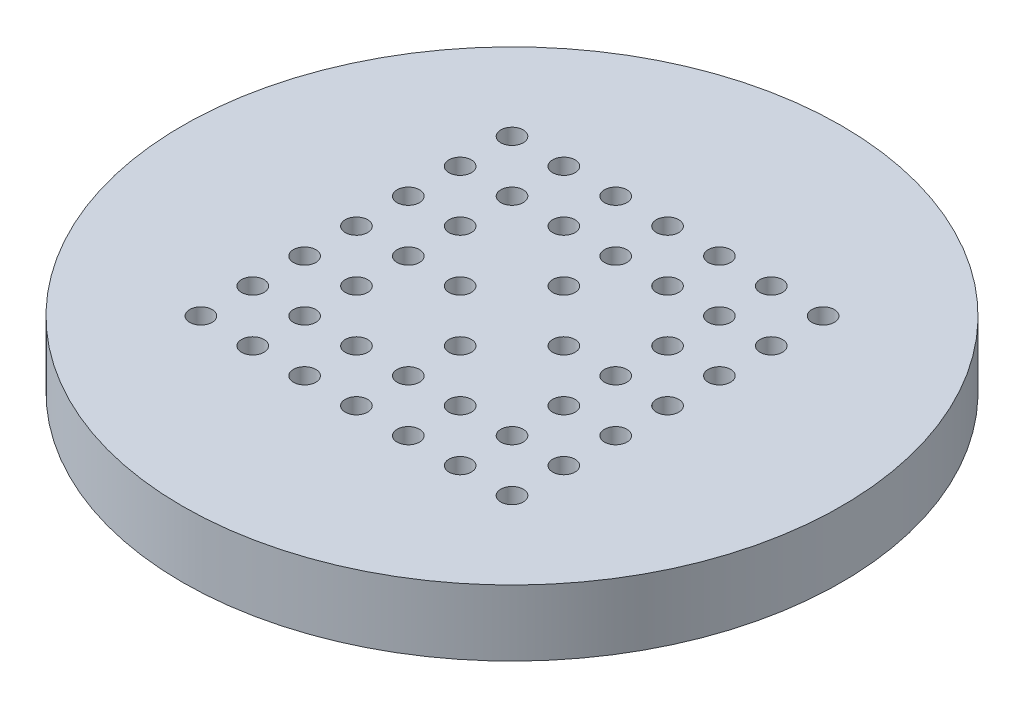
from build123d import *

# Parameters (mm, degrees)
SKETCH1_R                                 = 19.05
BILLET_DEPTH                              = 3.81
SKETCH2_R                                 = 0.6477
FIRST_LOX_HOLE_DEPTH                      = 28.208842313
BRAISING_CHAMFER_SIZE                     = 0.254
LOX_HOLE_PATTERN_COUNT                    = 7
LOX_HOLE_PATTERN_PITCH                    = 2.9972
LOX_HOLE_PATTERN_COUNT_DIR2               = 7
LOX_HOLE_PATTERN_PITCH_DIR2               = 2.9972
BRAISING_CHAMFER_OF_LOX_HOLE_PATTERN_SIZE = 0.254
SKETCH3_R                                 = 0.79375
DOWEL_HOLE_DEPTH                          = 1.905


with BuildPart() as part:
    # Sketch1 → Billet (new body)
    with BuildSketch(Plane(origin=(0, 0, 0), x_dir=(1, 0, 0), z_dir=(0, 1, 0))):
        Circle(SKETCH1_R)
    extrude(amount=-BILLET_DEPTH)

    # Sketch2 → First Lox Hole (cut, symmetric)
    with BuildSketch(Plane(origin=(0, 0, 0), x_dir=(1, 0, 0), z_dir=(0, 1, 0))):
        with Locations((8.9916, 8.9916)):
            Circle(SKETCH2_R)
    first_lox_hole = extrude(amount=FIRST_LOX_HOLE_DEPTH, both=True, mode=Mode.SUBTRACT)

    # Braising Chamfer
    braising_chamfer_edges = [part.edges().sort_by_distance(p)[0] for p in [
        (8.3439, -3.81, -8.9916),
    ]]
    chamfer(braising_chamfer_edges, length=BRAISING_CHAMFER_SIZE)

    # Lox Hole Pattern: First Lox Hole 7 × 7, 5 skipped
    with Locations(*[(-i * LOX_HOLE_PATTERN_PITCH, 0, j * LOX_HOLE_PATTERN_PITCH_DIR2) for i in range(LOX_HOLE_PATTERN_COUNT) for j in range(LOX_HOLE_PATTERN_COUNT_DIR2) if (i, j) not in ((0, 0), (2, 2), (2, 4), (3, 3), (4, 2), (4, 4))]):
        add(first_lox_hole, mode=Mode.SUBTRACT)

    # Braising Chamfer of Lox Hole Pattern
    braising_chamfer_of_lox_hole_pattern_edges = [part.edges().sort_by_distance(p)[0] for p in [
        (8.3439, -3.81, -5.9944),
        (8.3439, -3.81, -2.9972),
        (8.3439, -3.81, 0),
        (8.3439, -3.81, 2.9972),
        (8.3439, -3.81, 5.9944),
        (8.3439, -3.81, 8.9916),
        (5.3467, -3.81, -8.9916),
        (5.3467, -3.81, -5.9944),
        (5.3467, -3.81, -2.9972),
        (5.3467, -3.81, 0),
        (5.3467, -3.81, 2.9972),
        (5.3467, -3.81, 5.9944),
        (5.3467, -3.81, 8.9916),
        (2.3495, -3.81, -8.9916),
        (2.3495, -3.81, -5.9944),
        (2.3495, -3.81, 0),
        (2.3495, -3.81, 5.9944),
        (2.3495, -3.81, 8.9916),
        (-0.6477, -3.81, -8.9916),
        (-0.6477, -3.81, -5.9944),
        (-0.6477, -3.81, -2.9972),
        (-0.6477, -3.81, 2.9972),
        (-0.6477, -3.81, 5.9944),
        (-0.6477, -3.81, 8.9916),
        (-3.6449, -3.81, -8.9916),
        (-3.6449, -3.81, -5.9944),
        (-3.6449, -3.81, 0),
        (-3.6449, -3.81, 5.9944),
        (-3.6449, -3.81, 8.9916),
        (-6.6421, -3.81, -8.9916),
        (-6.6421, -3.81, -5.9944),
        (-6.6421, -3.81, -2.9972),
        (-6.6421, -3.81, 0),
        (-6.6421, -3.81, 2.9972),
        (-6.6421, -3.81, 5.9944),
        (-6.6421, -3.81, 8.9916),
        (-9.6393, -3.81, -8.9916),
        (-9.6393, -3.81, -5.9944),
        (-9.6393, -3.81, -2.9972),
        (-9.6393, -3.81, 0),
        (-9.6393, -3.81, 2.9972),
        (-9.6393, -3.81, 5.9944),
        (-9.6393, -3.81, 8.9916),
    ]]
    chamfer(braising_chamfer_of_lox_hole_pattern_edges, length=BRAISING_CHAMFER_OF_LOX_HOLE_PATTERN_SIZE)

    # Sketch3 → Dowel Hole (cut)
    with BuildSketch(Plane(origin=(0, -3.81, 0), x_dir=(-1, 0, 0), z_dir=(0, 1, 0))):
        with Locations((0, 15.24)):
            Circle(SKETCH3_R)
        with Locations((0, -15.24)):
            Circle(SKETCH3_R)
    extrude(amount=DOWEL_HOLE_DEPTH, mode=Mode.SUBTRACT)


solid = part.part
